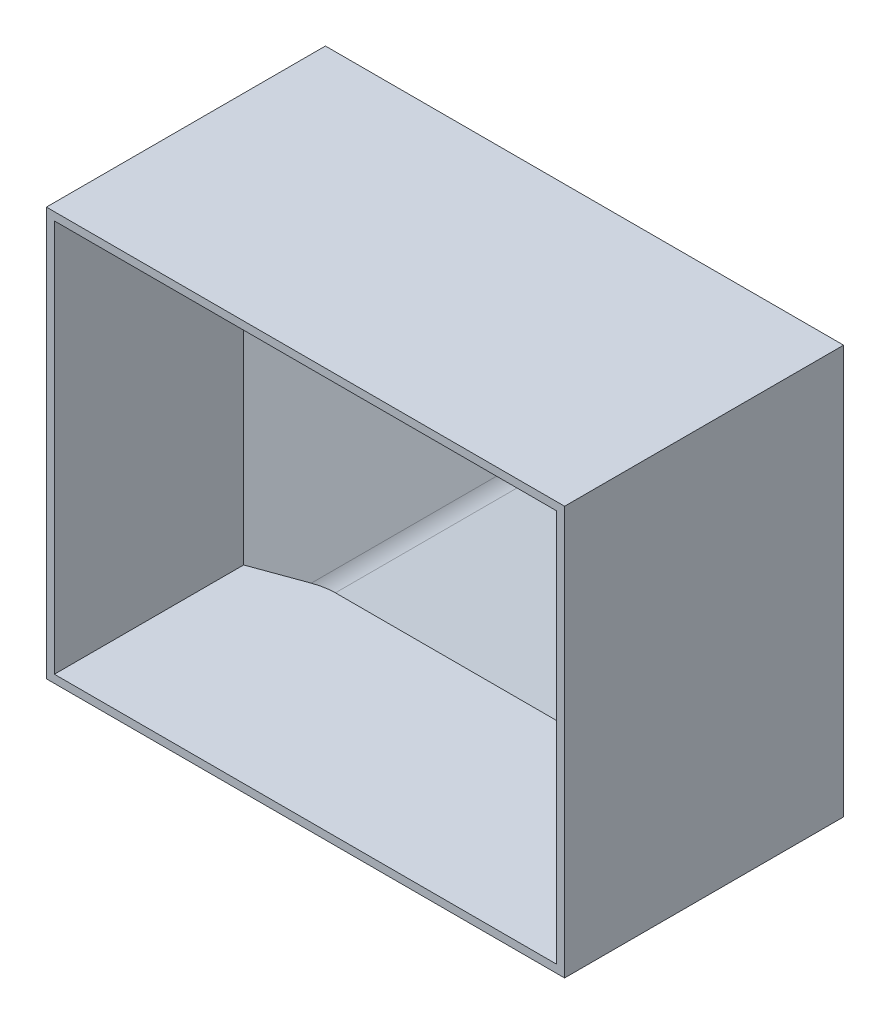
from build123d import *

# Parameters (mm, degrees)
SKETCH_1_W          = 260
SKETCH_1_H          = 205
SKETCH_1_W_2        = 252
SKETCH_1_H_2        = 197
EXTRUDE_1_DEPTH     = 140
SKETCH_2_W          = 260
SKETCH_2_H          = 205
EXTRUDE_1_2_DEPTH   = 5
SKETCH_3_R          = 10
CUT_EXTRUDE_1_DEPTH = 5
CHAMFER_1_SIZE      = 80
CHAMFER_1_SIZE2     = 29.117618741
CHAMFER_2_SIZE      = 110
CHAMFER_2_SIZE2     = 40.036725769
FILLET_1_R          = 15


with BuildPart() as part:
    # 草图1 → Extrude 1 (new body)
    with BuildSketch(Plane.XY):
        Rectangle(SKETCH_1_W, SKETCH_1_H)
        Rectangle(SKETCH_1_W_2, SKETCH_1_H_2, mode=Mode.SUBTRACT)
    extrude(amount=EXTRUDE_1_DEPTH)

    # 草图2 → Extrude 1 2 (add)
    with BuildSketch(Plane(origin=(0, 0, 0), x_dir=(-1, 0, 0), z_dir=(0, 0, -1))):
        Rectangle(SKETCH_2_W, SKETCH_2_H)
    extrude(amount=-EXTRUDE_1_2_DEPTH)

    # 草图3 → 切除-拉伸1 (cut)
    with BuildSketch(Plane(origin=(0, 0, 0), x_dir=(-1, 0, 0), z_dir=(0, 0, -1))):
        Circle(SKETCH_3_R)
    extrude(amount=-CUT_EXTRUDE_1_DEPTH, mode=Mode.SUBTRACT)

    # 倒角1
    chamfer_1_edges = [part.edges().sort_by_distance(p)[0] for p in [
        (0, -98.5, 5),
        (0, 98.5, 5),
    ]]
    chamfer_1_side = [part.faces().sort_by_distance(p)[0] for p in [
        (122.801359664, 0, 5),
    ]]
    chamfer(chamfer_1_edges, length=CHAMFER_1_SIZE, length2=CHAMFER_1_SIZE2, reference=chamfer_1_side[0])

    # 倒角2
    chamfer_2_edges = [part.edges().sort_by_distance(p)[0] for p in [
        (-126, 0, 5),
        (126, 0, 5),
    ]]
    chamfer_2_side = [part.faces().sort_by_distance(p)[0] for p in [
        (123.452982136, 0, 5),
    ]]
    chamfer(chamfer_2_edges, length=CHAMFER_2_SIZE, length2=CHAMFER_2_SIZE2, reference=chamfer_2_side[0])

    # 圆角1
    fillet_1_edges = [part.edges().sort_by_distance(p)[0] for p in [
        (56, 58.5, 19.558809371),
        (-56, 58.5, 19.558809371),
        (56, -58.5, 19.558809371),
        (-56, -58.5, 19.558809371),
    ]]
    fillet(fillet_1_edges, radius=FILLET_1_R)


solid = part.part
